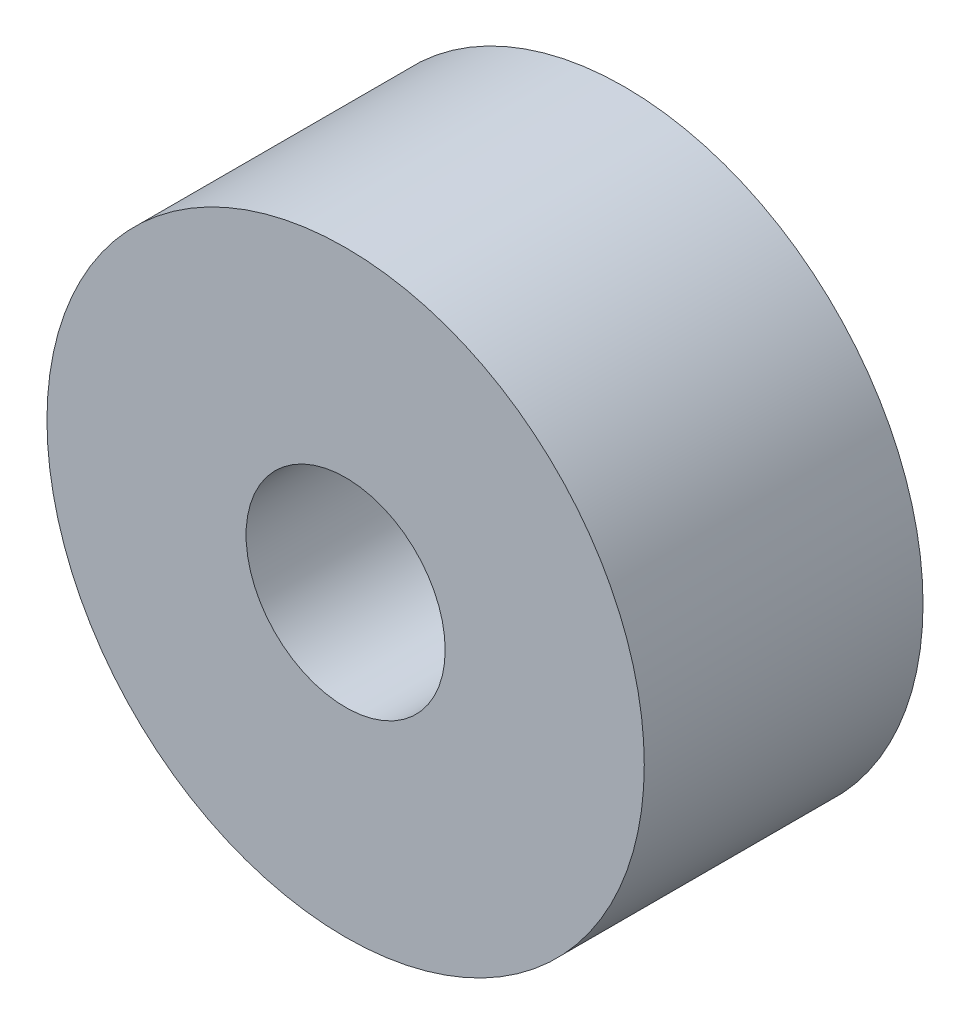
from build123d import *

# Parameters (mm, degrees)
SZKIC1_R                    = 15
SZKIC1_R_2                  = 5
DODANIE_WYCI_GNI_CIE1_DEPTH = 14


with BuildPart() as part:
    # Szkic1 → Dodanie-wyciągnięcie1 (new body)
    with BuildSketch(Plane.XY):
        Circle(SZKIC1_R)
        Circle(SZKIC1_R_2, mode=Mode.SUBTRACT)
    extrude(amount=DODANIE_WYCI_GNI_CIE1_DEPTH)


solid = part.part
